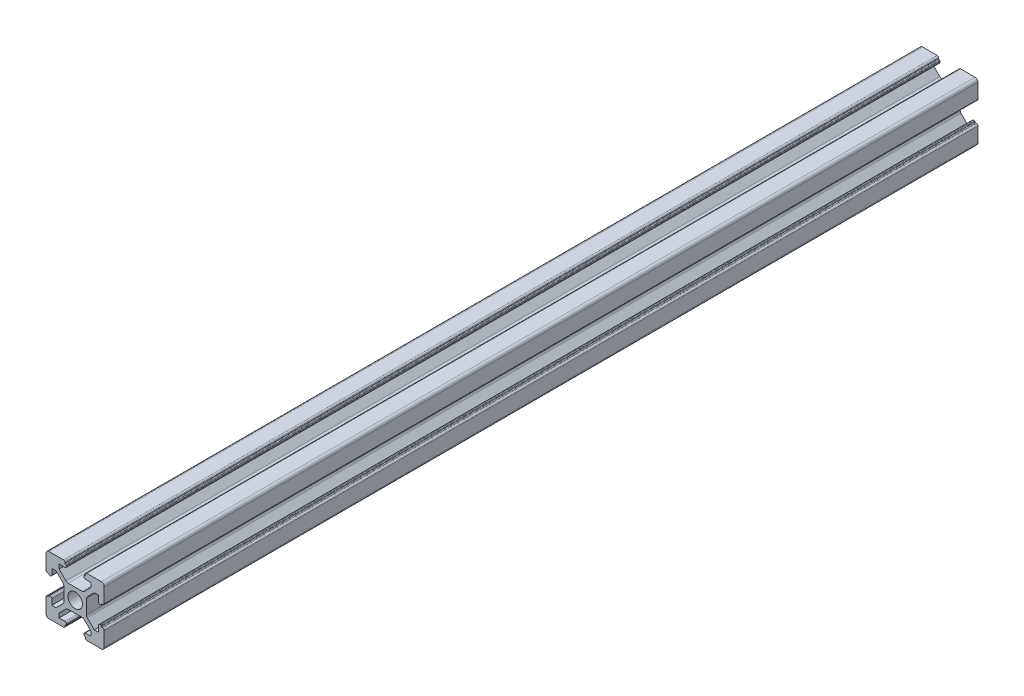
from build123d import *

# Parameters (mm, degrees)
SKETCH2_R           = 2.5
BOSS_EXTRUDE1_DEPTH = 300


with BuildPart() as part:
    # Sketch2 → Boss-Extrude1 (new body)
    with BuildSketch(Plane.XY):
        with BuildLine():
            ThreePointArc((4, 10), (3.646446609, 9.853553391), (3.5, 9.5))
            Line((3.5, 9.5), (3.5, 9.25))
            ThreePointArc((3.5, 9.25), (3.426776695, 9.073223305), (3.25, 9))
            Line((3.25, 9), (3.2, 9))
            ThreePointArc((3.2, 9), (3.058578644, 8.941421356), (3, 8.8))
            Line((3, 8.8), (3, 8.5))
            ThreePointArc((3, 8.5), (3.146446609, 8.146446609), (3.5, 8))
            Line((3.5, 8), (5.5, 8))
            Line((5.5, 8), (5.5, 6.560660172))
            Line((5.5, 6.560660172), (3.107233047, 4.167893219))
            ThreePointArc((3.107233047, 4.167893219), (2.782809698, 3.951120467), (2.400126266, 3.875))
            Line((2.400126266, 3.875), (0, 3.875))
            Line((0, 3.875), (-2.400126266, 3.875))
            ThreePointArc((-2.400126266, 3.875), (-2.782809698, 3.951120467), (-3.107233047, 4.167893219))
            Line((-3.107233047, 4.167893219), (-5.5, 6.560660172))
            Line((-5.5, 6.560660172), (-5.5, 8))
            Line((-5.5, 8), (-3.5, 8))
            ThreePointArc((-3.5, 8), (-3.146446609, 8.146446609), (-3, 8.5))
            Line((-3, 8.5), (-3, 8.8))
            ThreePointArc((-3, 8.8), (-3.058578644, 8.941421356), (-3.2, 9))
            Line((-3.2, 9), (-3.25, 9))
            ThreePointArc((-3.25, 9), (-3.426776695, 9.073223305), (-3.5, 9.25))
            Line((-3.5, 9.25), (-3.5, 9.5))
            ThreePointArc((-3.5, 9.5), (-3.646446609, 9.853553391), (-4, 10))
            Line((-4, 10), (-9, 10))
            ThreePointArc((-9, 10), (-9.707106781, 9.707106781), (-10, 9))
            Line((-10, 9), (-10, 4))
            ThreePointArc((-10, 4), (-9.853553391, 3.646446609), (-9.5, 3.5))
            Line((-9.5, 3.5), (-9.25, 3.5))
            ThreePointArc((-9.25, 3.5), (-9.073223305, 3.426776695), (-9, 3.25))
            Line((-9, 3.25), (-9, 3.2))
            ThreePointArc((-9, 3.2), (-8.941421356, 3.058578644), (-8.8, 3))
            Line((-8.8, 3), (-8.5, 3))
            ThreePointArc((-8.5, 3), (-8.146446609, 3.146446609), (-8, 3.5))
            Line((-8, 3.5), (-8, 5.5))
            Line((-8, 5.5), (-6.560660172, 5.5))
            Line((-6.560660172, 5.5), (-4.167893219, 3.107233047))
            ThreePointArc((-4.167893219, 3.107233047), (-3.951120467, 2.782809698), (-3.875, 2.400126266))
            Line((-3.875, 2.400126266), (-3.875, 0))
            Line((-3.875, 0), (-3.875, -2.400126266))
            ThreePointArc((-3.875, -2.400126266), (-3.951120467, -2.782809698), (-4.167893219, -3.107233047))
            Line((-4.167893219, -3.107233047), (-6.560660172, -5.5))
            Line((-6.560660172, -5.5), (-8, -5.5))
            Line((-8, -5.5), (-8, -3.5))
            ThreePointArc((-8, -3.5), (-8.146446609, -3.146446609), (-8.5, -3))
            Line((-8.5, -3), (-8.8, -3))
            ThreePointArc((-8.8, -3), (-8.941421356, -3.058578644), (-9, -3.2))
            Line((-9, -3.2), (-9, -3.25))
            ThreePointArc((-9, -3.25), (-9.073223305, -3.426776695), (-9.25, -3.5))
            Line((-9.25, -3.5), (-9.5, -3.5))
            ThreePointArc((-9.5, -3.5), (-9.853553391, -3.646446609), (-10, -4))
            Line((-10, -4), (-10, -9))
            ThreePointArc((-10, -9), (-9.707106781, -9.707106781), (-9, -10))
            Line((-9, -10), (-4, -10))
            ThreePointArc((-4, -10), (-3.646446609, -9.853553391), (-3.5, -9.5))
            Line((-3.5, -9.5), (-3.5, -9.25))
            ThreePointArc((-3.5, -9.25), (-3.426776695, -9.073223305), (-3.25, -9))
            Line((-3.25, -9), (-3.2, -9))
            ThreePointArc((-3.2, -9), (-3.058578644, -8.941421356), (-3, -8.8))
            Line((-3, -8.8), (-3, -8.5))
            ThreePointArc((-3, -8.5), (-3.146446609, -8.146446609), (-3.5, -8))
            Line((-3.5, -8), (-5.5, -8))
            Line((-5.5, -8), (-5.5, -6.560660172))
            Line((-5.5, -6.560660172), (-3.107233047, -4.167893219))
            ThreePointArc((-3.107233047, -4.167893219), (-2.782809698, -3.951120467), (-2.400126266, -3.875))
            Line((-2.400126266, -3.875), (0, -3.875))
            Line((0, -3.875), (2.400126266, -3.875))
            ThreePointArc((2.400126266, -3.875), (2.782809698, -3.951120467), (3.107233047, -4.167893219))
            Line((3.107233047, -4.167893219), (5.5, -6.560660172))
            Line((5.5, -6.560660172), (5.5, -8))
            Line((5.5, -8), (3.5, -8))
            ThreePointArc((3.5, -8), (3.146446609, -8.146446609), (3, -8.5))
            Line((3, -8.5), (3, -8.8))
            ThreePointArc((3, -8.8), (3.058578644, -8.941421356), (3.2, -9))
            Line((3.2, -9), (3.25, -9))
            ThreePointArc((3.25, -9), (3.426776695, -9.073223305), (3.5, -9.25))
            Line((3.5, -9.25), (3.5, -9.5))
            ThreePointArc((3.5, -9.5), (3.646446609, -9.853553391), (4, -10))
            Line((4, -10), (9, -10))
            ThreePointArc((9, -10), (9.707106781, -9.707106781), (10, -9))
            Line((10, -9), (10, -4))
            ThreePointArc((10, -4), (9.853553391, -3.646446609), (9.5, -3.5))
            Line((9.5, -3.5), (9.25, -3.5))
            ThreePointArc((9.25, -3.5), (9.073223305, -3.426776695), (9, -3.25))
            Line((9, -3.25), (9, -3.2))
            ThreePointArc((9, -3.2), (8.941421356, -3.058578644), (8.8, -3))
            Line((8.8, -3), (8.5, -3))
            ThreePointArc((8.5, -3), (8.146446609, -3.146446609), (8, -3.5))
            Line((8, -3.5), (8, -5.5))
            Line((8, -5.5), (6.560660172, -5.5))
            Line((6.560660172, -5.5), (4.167893219, -3.107233047))
            ThreePointArc((4.167893219, -3.107233047), (3.951120467, -2.782809698), (3.875, -2.400126266))
            Line((3.875, -2.400126266), (3.875, 0))
            Line((3.875, 0), (3.875, 2.400126266))
            ThreePointArc((3.875, 2.400126266), (3.951120467, 2.782809698), (4.167893219, 3.107233047))
            Line((4.167893219, 3.107233047), (6.560660172, 5.5))
            Line((6.560660172, 5.5), (8, 5.5))
            Line((8, 5.5), (8, 3.5))
            ThreePointArc((8, 3.5), (8.146446609, 3.146446609), (8.5, 3))
            Line((8.5, 3), (8.8, 3))
            ThreePointArc((8.8, 3), (8.941421356, 3.058578644), (9, 3.2))
            Line((9, 3.2), (9, 3.25))
            ThreePointArc((9, 3.25), (9.073223305, 3.426776695), (9.25, 3.5))
            Line((9.25, 3.5), (9.5, 3.5))
            ThreePointArc((9.5, 3.5), (9.853553391, 3.646446609), (10, 4))
            Line((10, 4), (10, 9))
            ThreePointArc((10, 9), (9.707106781, 9.707106781), (9, 10))
            Line((9, 10), (4, 10))
        make_face()
        Circle(SKETCH2_R, mode=Mode.SUBTRACT)
    extrude(amount=BOSS_EXTRUDE1_DEPTH)


solid = part.part
